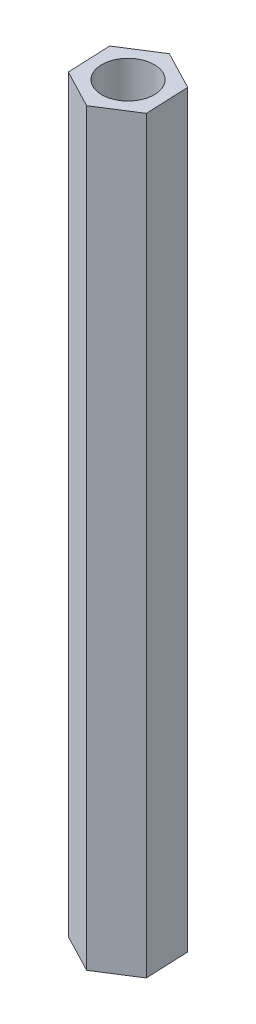
from build123d import *

# Parameters (mm, degrees)
SKETCH_1_R      = 2.1
EXTRUDE_1_DEPTH = 60


with BuildPart() as part:
    # 草图1 → 凸台-拉伸1 (new body)
    with BuildSketch(Plane(origin=(0, 0, 0), x_dir=(1, 0, 0), z_dir=(0, 1, 0))):
        Polygon((3.070700034, -1.603371853), (2.923910774, 1.85761831), (-0.14678926, 3.460990164), (-3.070700034, 1.603371853), (-2.923910774, -1.85761831), (0.14678926, -3.460990164), align=None)
        with Locations(Location((0, 0, 0), (0, 0, 270))):
            Circle(SKETCH_1_R, mode=Mode.SUBTRACT)
    extrude(amount=EXTRUDE_1_DEPTH)


solid = part.part
